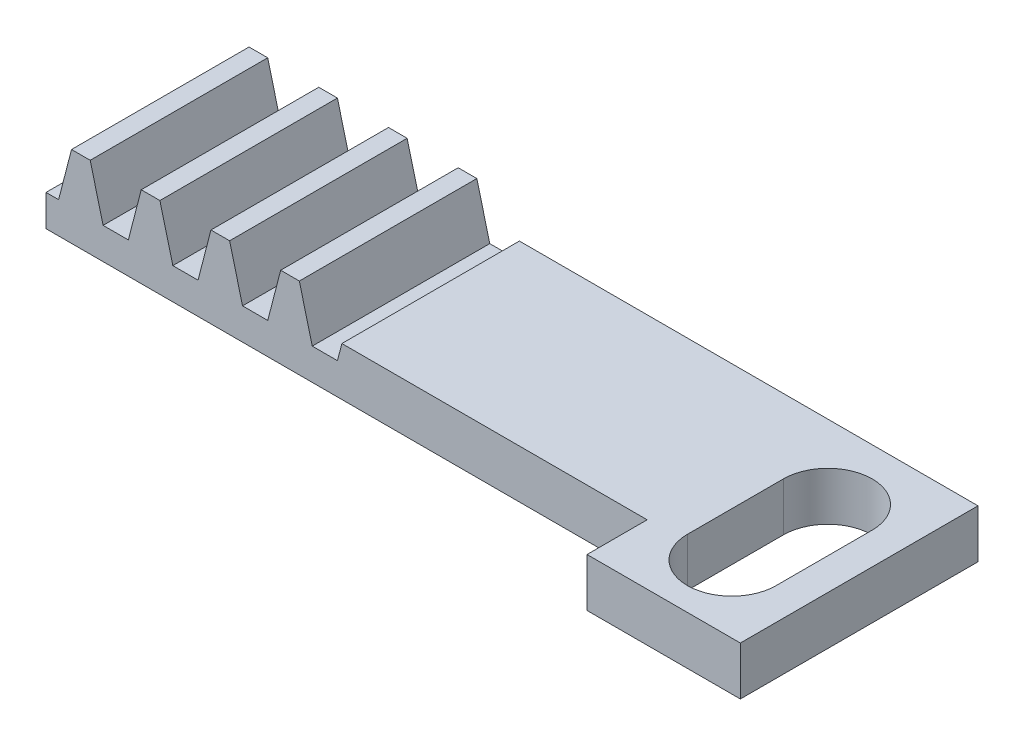
from build123d import *

# Parameters (mm, degrees)
BLANKSKE_W          = 20
BLANKSKE_H          = 5.5
BLANK_DEPTH         = 12
TOOTHCUTSIM_DEPTH   = 24.963513933
TEETHCUTS_COUNT     = 5
TEETHCUTS_PITCH     = 4.712388975
SKETCH2_W           = 12
SKETCH2_H           = 3.278265845
BOSS_EXTRUDE1_DEPTH = 31
CUT_EXTRUDE2_REACH  = 54.495
BOSS_EXTRUDE2_DEPTH = 3.278266
CUT_EXTRUDE3_DEPTH  = 22.5


with BuildPart() as part:
    # BlankSke → Blank (new body)
    with BuildSketch(Plane.XY):
        with Locations((10, 2.75)):
            Rectangle(BLANKSKE_W, BLANKSKE_H)
    extrude(amount=-BLANK_DEPTH)

    # TooCutSkeSim → ToothCutSim (cut, through all)
    with BuildSketch(Plane.XY):
        Polygon((0.852189273, 2.125), (-0.852189273, 2.125), (-1.731592507, 5.5254), (1.731592507, 5.5254), align=None)
    toothcutsim = extrude(amount=-TOOTHCUTSIM_DEPTH, mode=Mode.SUBTRACT)

    # TeethCuts: ToothCutSim ×5
    with Locations(*[(i * TEETHCUTS_PITCH, 0, 0) for i in range(1, TEETHCUTS_COUNT)]):
        add(toothcutsim, mode=Mode.SUBTRACT)

    # Sketch2 → Boss-Extrude1 (add)
    with BuildSketch(Plane(origin=(20, 0, 0), x_dir=(0, 0, -1), z_dir=(1, 0, 0))):
        with Locations((6, 1.639132923)):
            Rectangle(SKETCH2_W, SKETCH2_H)
    extrude(amount=BOSS_EXTRUDE1_DEPTH)

    # Sketch3 → Cut-Extrude2 (cut, up to next)
    with BuildSketch(Plane(origin=(0, 3.278265845, 0), x_dir=(1, 0, 0), z_dir=(0, 1, 0)), mode=Mode.PRIVATE) as cut_extrude2_sk1:
        with BuildLine():
            Line((48.847, 7), (48.847, 5))
            ThreePointArc((48.847, 5), (45.847, 2), (42.847, 5))
            Line((42.847, 5), (42.847, 7))
            ThreePointArc((42.847, 7), (45.847, 10), (48.847, 7))
        make_face()
    cut_extrude2_tool1 = extrude(cut_extrude2_sk1.sketch, amount=-CUT_EXTRUDE2_REACH, mode=Mode.PRIVATE) & part.part
    add(cut_extrude2_tool1.solids().sort_by_distance((45.847, 3.278266, -6))[0], mode=Mode.SUBTRACT)

    # Sketch5 → Boss-Extrude2 (add)
    with BuildSketch(Plane(origin=(0, 3.278265845, 0), x_dir=(1, 0, 0), z_dir=(0, 1, 0))):
        with BuildLine():
            Line((42.890323487, 0), (40.636775161, 0))
            Line((40.636775161, 0), (40.636775161, -4.064))
            Line((40.636775161, -4.064), (51, -4.064))
            Line((51, -4.064), (51, 0))
            Line((51, 0), (48.803676513, 0))
            ThreePointArc((48.803676513, 0), (45.847, -2.492), (42.890323487, 0))
        make_face()
    extrude(amount=-BOSS_EXTRUDE2_DEPTH)

    # Sketch6 → Cut-Extrude3 (cut)
    with BuildSketch(Plane(origin=(0, 3.278265845, 0), x_dir=(1, 0, 0), z_dir=(0, 1, 0))):
        with BuildLine():
            Line((48.847, 7), (48.847, 0.508))
            ThreePointArc((48.847, 0.508), (45.847, -2.492), (42.847, 0.508))
            Line((42.847, 0.508), (42.847, 7))
            ThreePointArc((42.847, 7), (45.847, 10), (48.847, 7))
        make_face()
    extrude(amount=-CUT_EXTRUDE3_DEPTH, mode=Mode.SUBTRACT)


solid = part.part
